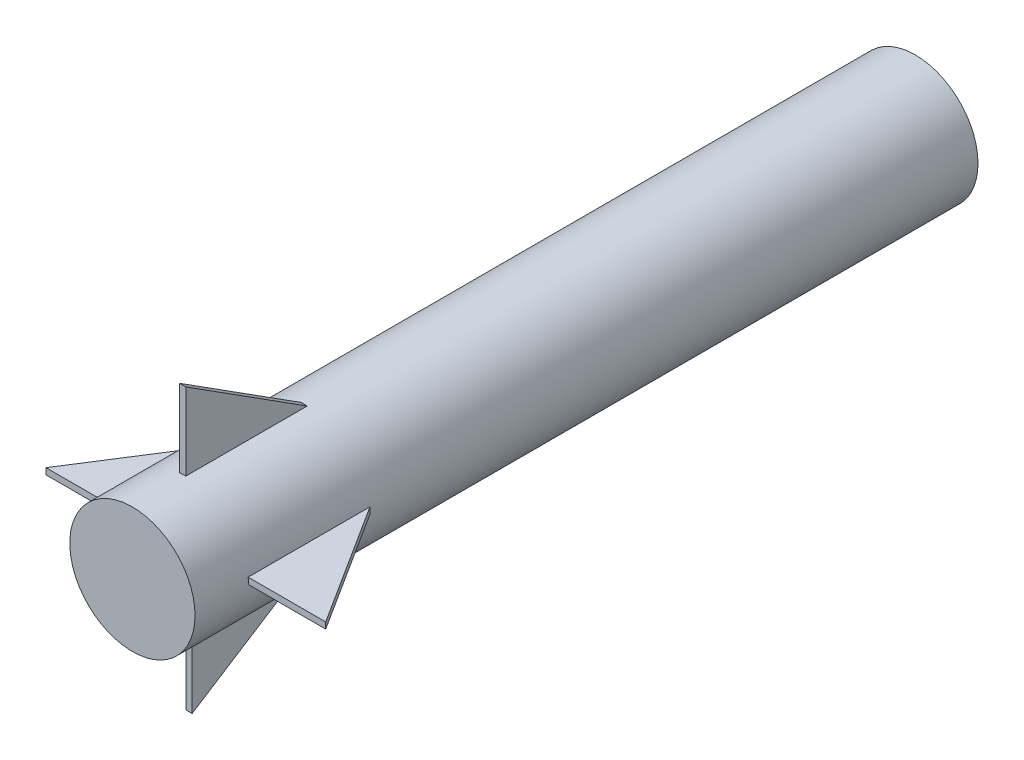
from build123d import *

# Parameters (mm, degrees)
SZKIC1_R                    = 80
DODANIE_WYCI_GNI_CIE1_DEPTH = 1000
DODANIE_WYCI_GNI_CIE2_DEPTH = 8
SZYK_KO_OWY1_COUNT          = 4


with BuildPart() as part:
    # Szkic1 → Dodanie-wyciągnięcie1 (new body)
    with BuildSketch(Plane.XY):
        Circle(SZKIC1_R)
    extrude(amount=DODANIE_WYCI_GNI_CIE1_DEPTH)

    # Szkic5 → Dodanie-wyciągnięcie2 (add)
    with BuildSketch(Plane(origin=(0, 0, 0), x_dir=(1, 0, 0), z_dir=(0, 1, 0))):
        Polygon((73.616187197, -766.737875277), (178.616187197, -931.737875277), (73.616187197, -931.737875277), align=None)
    dodanie_wyci_gni_cie2 = extrude(amount=DODANIE_WYCI_GNI_CIE2_DEPTH)

    # Szyk kołowy1: Dodanie-wyciągnięcie2 ×4 about axis
    szyk_ko_owy1_axis = Axis((0, 0, 0), (0, 0, 1))
    for i in range(1, SZYK_KO_OWY1_COUNT):
        add(dodanie_wyci_gni_cie2.rotate(szyk_ko_owy1_axis, i * 360 / SZYK_KO_OWY1_COUNT))


solid = part.part
